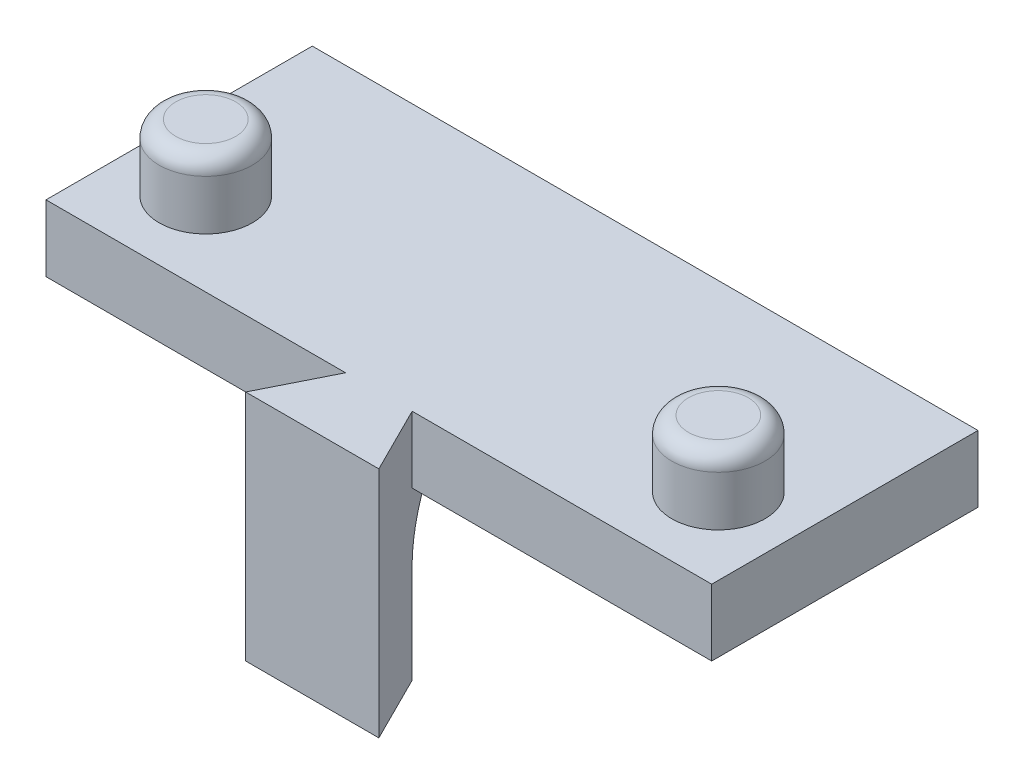
from build123d import *

# Parameters (mm, degrees)
BOSS_EXTRUDE1_DEPTH = 2
SKETCH2_R           = 1.4000000000000001
SKETCH2_R_2         = 1.399999999999999
BOSS_EXTRUDE2_DEPTH = 2
FILLET1_R           = 0.5
BOSS_EXTRUDE3_DEPTH = 5
FILLET2_R           = 2


with BuildPart() as part:
    # Sketch1 → Boss-Extrude1 (new body)
    with BuildSketch(Plane(origin=(0, 0, 0), x_dir=(1, 0, 0), z_dir=(0, 1, 0))):
        Polygon((0, 0), (20, 0), (20, -8), (11.000000000000002, -8), (12, -10), (8.000000000000002, -10), (9.000000000000002, -8), (9.8e-16, -8), align=None)
    extrude(amount=BOSS_EXTRUDE1_DEPTH)

    # Sketch2 → Boss-Extrude2 (add)
    with BuildSketch(Plane(origin=(0, 2, 0), x_dir=(1, 0, 0), z_dir=(0, 1, 0))):
        with Locations(Location((2.3000000000000007, -5.5, 0), (0, 0, 270))):
            Circle(SKETCH2_R)
        with Locations(Location((17.7, -5.499999999999998, 0), (0, 0, 90))):
            Circle(SKETCH2_R_2)
    extrude(amount=BOSS_EXTRUDE2_DEPTH)

    # Fillet1
    fillet1_edges = [part.edges().sort_by_distance(p)[0] for p in [
        (2.3000000000000016, 4, 4.1),
        (17.7, 4, 6.899999999999997),
    ]]
    fillet(fillet1_edges, radius=FILLET1_R)

    # Sketch3 → Boss-Extrude3 (add)
    with BuildSketch(Plane.XZ):
        Polygon((8.000000000000002, 10), (12, 10), (11.000000000000002, 8), (9.000000000000002, 8), align=None)
    extrude(amount=BOSS_EXTRUDE3_DEPTH)

    # Fillet2
    fillet2_edges = [part.edges().sort_by_distance(p)[0] for p in [
        (10.000000000000002, 0, 8),
    ]]
    fillet(fillet2_edges, radius=FILLET2_R)


solid = part.part
